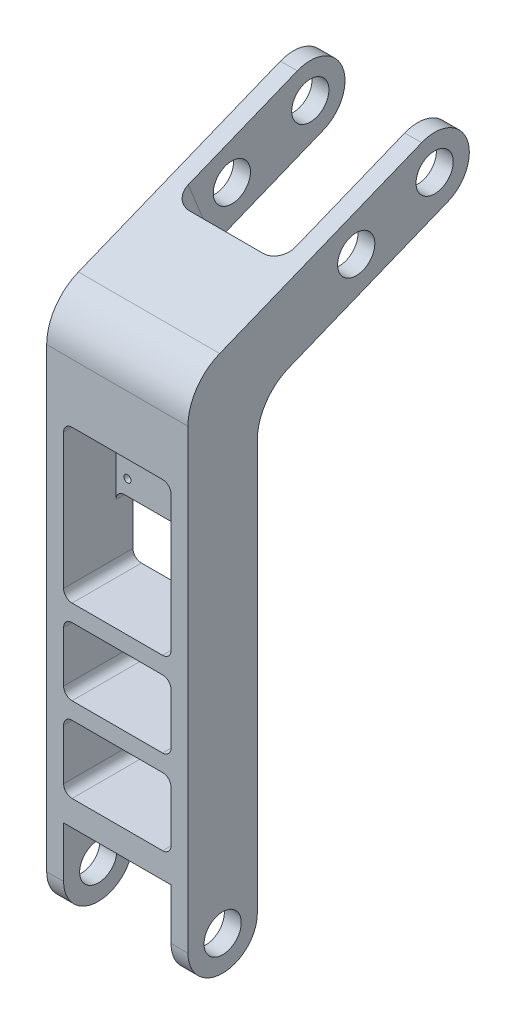
from build123d import *

# Parameters (mm, degrees)
EXTRUDE_1_DEPTH        = 41
EXTRUDE_2_DEPTH        = 10
SKETCH_3_R             = 11
CUT_EXTRUDE_1_DEPTH    = 10
SKETCH_4_W             = 83.5
SKETCH_4_H             = 41
EXTRUDE_3_DEPTH        = 250
CUT_EXTRUDE_2_DEPTH    = 309
EXTRUDE_5_DEPTH        = 83.5
EXTRUDE_6_DEPTH        = 41.75
FILLET_1_R             = 8
SKETCH_10_R            = 5.5
CUT_EXTRUDE_3_DEPTH    = 92
EXTRUDE_9_DEPTH        = 41.75
SKETCH_15_R            = 11
CUT_EXTRUDE_5_DEPTH    = 92.5
SKETCH_16_W            = 63.5
SKETCH_16_H            = 100
CUT_EXTRUDE_6_DEPTH    = 65
FILLET_3_R             = 30
CUT_EXTRUDE_7_DEPTH    = 37.75
SKETCH_19_W            = 70.175183739
SKETCH_19_H            = 41.669127314
CUT_EXTRUDE_8_DEPTH    = 90.5
HOLE_WIZARD_M5_1_D     = 4.2
HOLE_WIZARD_M5_1_DEPTH = 10
HOLE_WIZARD_M5_1_TIP   = 1.2618073
FILLET_5_R             = 10
CUT_EXTRUDE_9_DEPTH    = 31


with BuildPart() as part:
    # 草图1 → 凸台-拉伸1 (new body)
    with BuildSketch(Plane.XY):
        Polygon((0, 0), (0, 40), (83.5, 40), (83.5, 0), (73.5, 0), (73.5, 30), (10, 30), (10, 0), align=None)
    extrude(amount=EXTRUDE_1_DEPTH)

    # 草图2 → 凸台-拉伸2 (add)
    with BuildSketch(Plane(origin=(83.5, 0, 0), x_dir=(0, 0, -1), z_dir=(1, 0, 0))):
        with BuildLine():
            Line((-41, 0), (0, 0))
            ThreePointArc((0, 0), (-20.5, -20.5), (-41, 0))
        make_face()
    extrude_2 = extrude(amount=-EXTRUDE_2_DEPTH)

    # 草图3 → 切除-拉伸1 (cut)
    with BuildSketch(Plane(origin=(83.5, 0, 0), x_dir=(0, 0, -1), z_dir=(1, 0, 0))):
        with Locations(Location((-20.5, 0, 0), (0, 0, 90))):
            Circle(SKETCH_3_R)
    cut_extrude_1 = extrude(amount=-CUT_EXTRUDE_1_DEPTH, mode=Mode.SUBTRACT)

    # 镜向1: 凸台-拉伸2, 切除-拉伸1 across plane
    add(extrude_2.mirror(Plane(origin=(41.75, 0, 0), x_dir=(0, 0, 1), z_dir=(1, 0, 0))))
    add(cut_extrude_1.mirror(Plane(origin=(41.75, 0, 0), x_dir=(0, 0, 1), z_dir=(1, 0, 0))), mode=Mode.SUBTRACT)

    # 草图4 → 凸台-拉伸3 (add)
    with BuildSketch(Plane(origin=(0, 40, 0), x_dir=(1, 0, 0), z_dir=(0, 1, 0))):
        with Locations((41.75, -20.5)):
            Rectangle(SKETCH_4_W, SKETCH_4_H)
    extrude(amount=EXTRUDE_3_DEPTH)

    # 草图5 → 切除-拉伸2 (cut)
    with BuildSketch(Plane.XY.offset(41)):
        with BuildLine():
            Line((15, 45), (68.5, 45))
            ThreePointArc((68.5, 45), (72.035533906, 46.464466094), (73.5, 50))
            Line((73.5, 50), (73.5, 80))
            ThreePointArc((73.5, 80), (72.035533906, 83.535533906), (68.5, 85))
            Line((68.5, 85), (15, 85))
            ThreePointArc((15, 85), (11.464466094, 83.535533906), (10, 80))
            Line((10, 80), (10, 50))
            ThreePointArc((10, 50), (11.464466094, 46.464466094), (15, 45))
        make_face()
        with BuildLine():
            Line((10, 100), (10, 130))
            ThreePointArc((10, 130), (11.464466094, 133.535533906), (15, 135))
            Line((15, 135), (68.5, 135))
            ThreePointArc((68.5, 135), (72.035533906, 133.535533906), (73.5, 130))
            Line((73.5, 130), (73.5, 100))
            ThreePointArc((73.5, 100), (72.035533906, 96.464466094), (68.5, 95))
            Line((68.5, 95), (15, 95))
            ThreePointArc((15, 95), (11.464466094, 96.464466094), (10, 100))
        make_face()
        with BuildLine():
            Line((10, 150), (10, 180))
            ThreePointArc((10, 180), (11.464466094, 183.535533906), (15, 185))
            Line((15, 185), (68.5, 185))
            ThreePointArc((68.5, 185), (72.035533906, 183.535533906), (73.5, 180))
            Line((73.5, 180), (73.5, 150))
            ThreePointArc((73.5, 150), (72.035533906, 146.464466094), (68.5, 145))
            Line((68.5, 145), (15, 145))
            ThreePointArc((15, 145), (11.464466094, 146.464466094), (10, 150))
        make_face()
    extrude(amount=-CUT_EXTRUDE_2_DEPTH, mode=Mode.SUBTRACT)

    # 草图7 → 凸台-拉伸5 (add)
    with BuildSketch(Plane(origin=(83.5, 0, 0), x_dir=(0, 0, -1), z_dir=(1, 0, 0))):
        Polygon((0, 262.345150809), (112.486411563, 307.792611131), (97.127541233, 345.807149168), (-41, 290), align=None)
    extrude(amount=-EXTRUDE_5_DEPTH)

    # 草图8 → 凸台-拉伸6 (add, symmetric)
    with BuildSketch(Plane(origin=(41.75, 0, 0), x_dir=(0, 0, -1), z_dir=(1, 0, 0))):
        Polygon((0, 232.345150809), (0, 192.345150809), (55, 192.345150809), (55, 210.345150809), align=None)
    extrude(amount=EXTRUDE_6_DEPTH, both=True)

    # 圆角1
    fillet_1_edges = [part.edges().sort_by_distance(p)[0] for p in [
        (41.75, 192.345150809, -55),
    ]]
    fillet(fillet_1_edges, radius=FILLET_1_R)

    # 草图10 → 切除-拉伸3 (cut)
    with BuildSketch(Plane(origin=(83.5, 0, 0), x_dir=(0, 0, -1), z_dir=(1, 0, 0))):
        with Locations(Location((47, 200.345150809, 0), (0, 0, 90))):
            Circle(SKETCH_10_R)
    extrude(amount=-CUT_EXTRUDE_3_DEPTH, mode=Mode.SUBTRACT)

    # 草图14 → 凸台-拉伸9 (add, symmetric)
    with BuildSketch(Plane(origin=(41.75, 0, 0), x_dir=(0, 0, -1), z_dir=(1, 0, 0))):
        with BuildLine():
            Line((97.127541233, 345.807149168), (112.486411563, 307.792611131))
            ThreePointArc((112.486411563, 307.792611131), (123.814245417, 334.479315315), (97.127541233, 345.807149168))
        make_face()
    extrude(amount=EXTRUDE_9_DEPTH, both=True)

    # 草图15 → 切除-拉伸5 (cut, symmetric)
    with BuildSketch(Plane(origin=(83.5, 0, 0), x_dir=(0, 0, -1), z_dir=(1, 0, 0))):
        with Locations((104.806976398, 326.79988015)):
            Circle(SKETCH_15_R)
        with Locations((58.44778367, 308.069550479)):
            Circle(SKETCH_15_R)
    extrude(amount=CUT_EXTRUDE_5_DEPTH, both=True, mode=Mode.SUBTRACT)

    # 草图16 → 切除-拉伸6 (cut)
    with BuildSketch(Plane(origin=(0, 263.544767644, 106.47899781), x_dir=(1, 0, 0), z_dir=(0, 0.9271838545667882, 0.37460659341591007))):
        with Locations((41.75, 190.096726194)):
            Rectangle(SKETCH_16_W, SKETCH_16_H)
    extrude(amount=-CUT_EXTRUDE_6_DEPTH, mode=Mode.SUBTRACT)

    # 圆角3
    fillet_3_edges = [part.edges().sort_by_distance(p)[0] for p in [
        (41.75, 262.345150809, 0),
        (41.75, 290, 41),
    ]]
    fillet(fillet_3_edges, radius=FILLET_3_R)

    # 草图8<2> → 切除-拉伸7 (cut, symmetric)
    with BuildSketch(Plane(origin=(41.75, 0, 0), x_dir=(0, 0, -1), z_dir=(1, 0, 0))):
        Polygon((0, 232.345150809), (0, 192.345150809), (55, 192.345150809), (55, 210.345150809), align=None)
    extrude(amount=CUT_EXTRUDE_7_DEPTH, both=True, mode=Mode.SUBTRACT)

    # 草图19 → 切除-拉伸8 (cut)
    with BuildSketch(Plane(origin=(83.5, 0, 0), x_dir=(0, 0, -1), z_dir=(1, 0, 0))):
        with Locations((35.08759187, 211.510587152)):
            Rectangle(SKETCH_19_W, SKETCH_19_H)
    extrude(amount=-CUT_EXTRUDE_8_DEPTH, mode=Mode.SUBTRACT)

    # M5 螺纹孔的螺纹孔钻头1
    with Locations(Plane(origin=(66.75, 214, 0), x_dir=(-1, 0, 0), z_dir=(0, 0, -1))):
        with Locations((0, 0), (50, 0), (50, -20), (0, -20)):
            Hole(HOLE_WIZARD_M5_1_D / 2, depth=HOLE_WIZARD_M5_1_DEPTH)
            with Locations((0, 0, -(HOLE_WIZARD_M5_1_DEPTH + HOLE_WIZARD_M5_1_TIP / 2))):  # 118° drill point
                Cone(0, HOLE_WIZARD_M5_1_D / 2, HOLE_WIZARD_M5_1_TIP, mode=Mode.SUBTRACT)

    # 圆角5
    fillet_5_edges = [part.edges().sort_by_distance(p)[0] for p in [
        (10, 297.018655973, -31.09585996),
        (73.5, 297.018655973, -31.09585996),
    ]]
    fillet(fillet_5_edges, radius=FILLET_5_R)

    # 草图22 → 切除-拉伸9 (cut)
    with BuildSketch(Plane.XY.offset(41)):
        with BuildLine():
            Line((10, 190), (10, 230))
            ThreePointArc((10, 230), (11.464466094, 233.535533906), (15, 235))
            Line((15, 235), (68.5, 235))
            ThreePointArc((68.5, 235), (72.035533906, 233.535533906), (73.5, 230))
            Line((73.5, 230), (73.5, 190))
            Line((73.5, 190), (73.5, 177.902541229))
            Line((73.5, 177.902541229), (10, 177.902541229))
            Line((10, 177.902541229), (10, 190))
        make_face()
    extrude(amount=-CUT_EXTRUDE_9_DEPTH, mode=Mode.SUBTRACT)


solid = part.part
